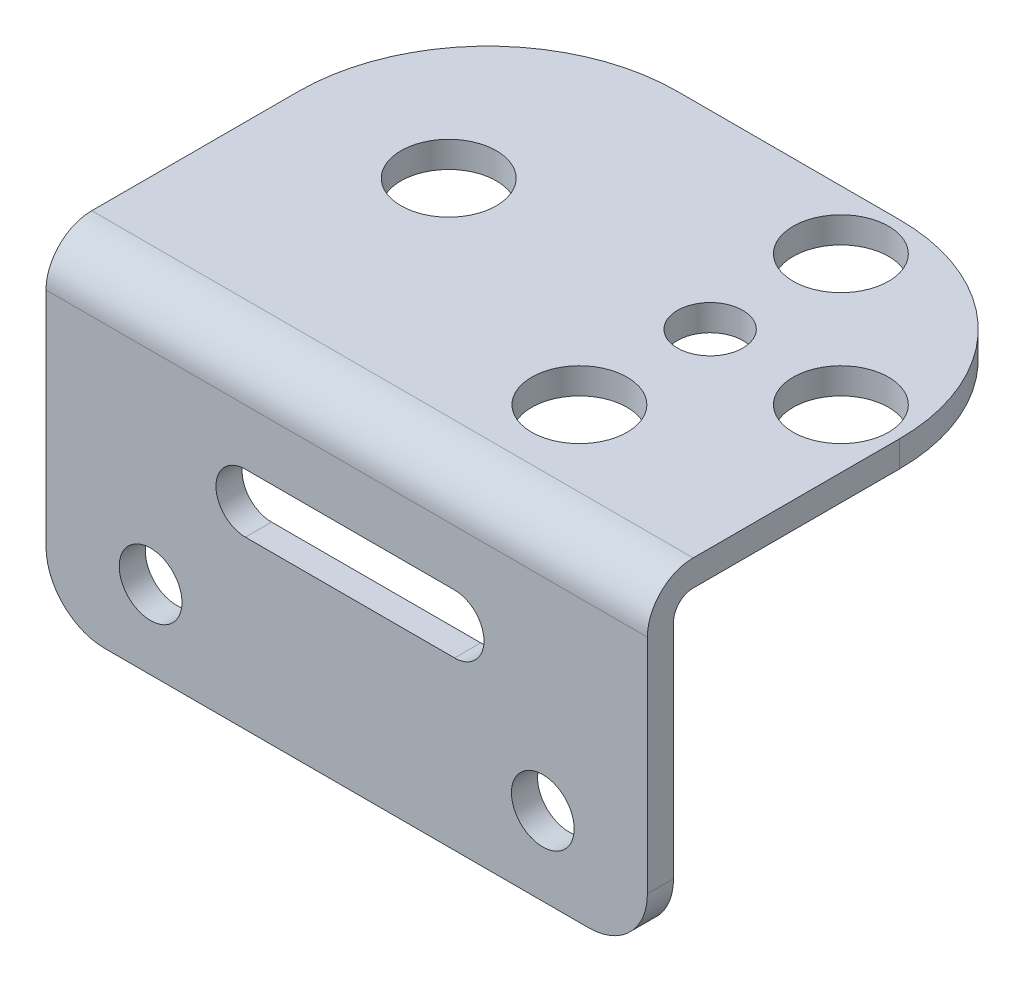
from build123d import *

# Parameters (mm, degrees)
SKETCH_3_W          = 46
SKETCH_3_H          = 33.8
EXTRUDE_1_DEPTH     = 2
FILLET_1_R          = 14.5
SKETCH_4_R          = 2.5
SKETCH_4_R_2        = 3.65
CUT_EXTRUDE_1_DEPTH = 2
SKETCH_5_W          = 46
SKETCH_5_H          = 2
EXTRUDE_2_DEPTH     = 23
FILLET_2_R          = 4.5
FILLET_3_R          = 3.5
FILLET_4_R          = 1.5
SKETCH_6_R          = 2.4
CUT_EXTRUDE_2_DEPTH = 25


with BuildPart() as part:
    # 草图3 → 凸台-拉伸1 (new body)
    with BuildSketch(Plane(origin=(0, 0, 0), x_dir=(1, 0, 0), z_dir=(0, 1, 0))):
        with Locations((23, 16.9)):
            Rectangle(SKETCH_3_W, SKETCH_3_H)
    extrude(amount=EXTRUDE_1_DEPTH)

    # 圆角1
    fillet_1_edges = [part.edges().sort_by_distance(p)[0] for p in [
        (0, 1, -33.8),
        (46, 1, -33.8),
    ]]
    fillet(fillet_1_edges, radius=FILLET_1_R)

    # 草图4 → 切除-拉伸1 (cut)
    with BuildSketch(Plane(origin=(0, 2, 0), x_dir=(1, 0, 0), z_dir=(0, 1, 0))):
        with Locations(Location((31.5, 19.3, 0), (0, 0, 270))):
            Circle(SKETCH_4_R)
        with Locations(Location((41.5, 19.3, 0), (0, 0, 270))):
            Circle(SKETCH_4_R_2)
        with Locations(Location((31.5, 29.3, 0), (0, 0, 270))):
            Circle(SKETCH_4_R_2)
        with Locations(Location((31.5, 9.3, 0), (0, 0, 270))):
            Circle(SKETCH_4_R_2)
        with Locations(Location((11.5, 19.3, 0), (0, 0, 270))):
            Circle(SKETCH_4_R_2)
    extrude(amount=-CUT_EXTRUDE_1_DEPTH, mode=Mode.SUBTRACT)

    # 草图5 → 凸台-拉伸2 (add)
    with BuildSketch(Plane.XZ):
        with Locations((23, -1)):
            Rectangle(SKETCH_5_W, SKETCH_5_H)
    extrude(amount=EXTRUDE_2_DEPTH)

    # 圆角2
    fillet_2_edges = [part.edges().sort_by_distance(p)[0] for p in [
        (0, -23, -1),
        (46, -23, -1),
    ]]
    fillet(fillet_2_edges, radius=FILLET_2_R)

    # 圆角3
    fillet_3_edges = [part.edges().sort_by_distance(p)[0] for p in [
        (23, 2, 0),
    ]]
    fillet(fillet_3_edges, radius=FILLET_3_R)

    # 圆角4
    fillet_4_edges = [part.edges().sort_by_distance(p)[0] for p in [
        (23, 0, -2),
    ]]
    fillet(fillet_4_edges, radius=FILLET_4_R)

    # 草图6 → 切除-拉伸2 (cut)
    with BuildSketch(Plane.XY):
        with Locations((8, -17)):
            Circle(SKETCH_6_R)
        with Locations((38, -17)):
            Circle(SKETCH_6_R)
        with BuildLine():
            Line((15.25, -5.75), (31.25, -5.75))
            ThreePointArc((31.25, -5.75), (33.5, -8), (31.25, -10.25))
            Line((31.25, -10.25), (15.25, -10.25))
            ThreePointArc((15.25, -10.25), (13, -8), (15.25, -5.75))
        make_face()
    extrude(amount=-CUT_EXTRUDE_2_DEPTH, mode=Mode.SUBTRACT)


solid = part.part
